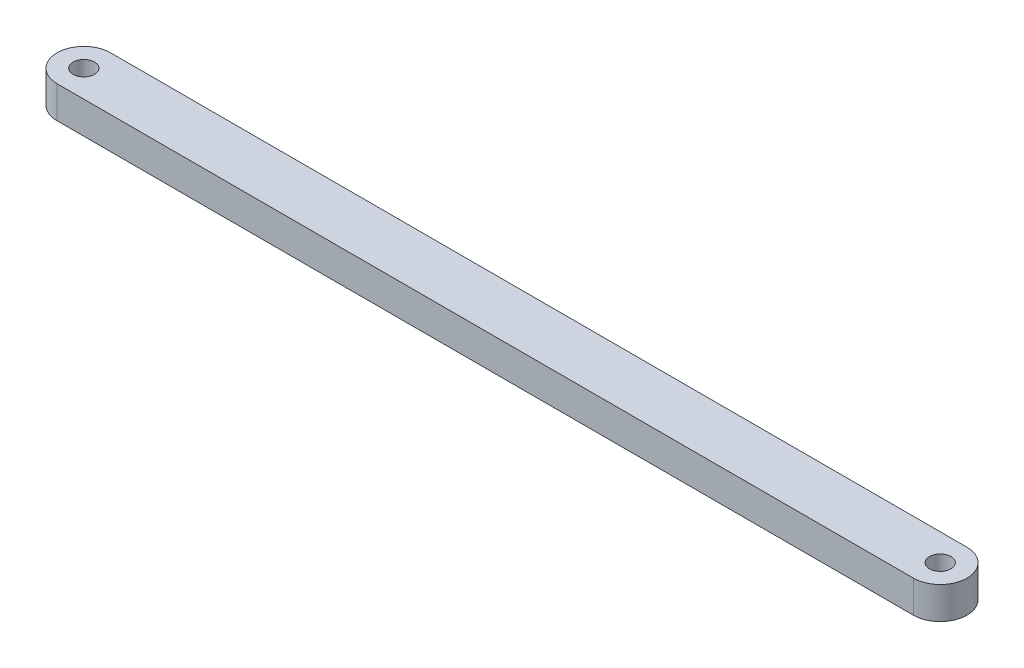
from build123d import *

# Parameters (mm, degrees)
SKETCH1_R           = 10
BOSS_EXTRUDE1_DEPTH = 30


with BuildPart() as part:
    # Sketch1 → Boss-Extrude1 (new body)
    with BuildSketch(Plane(origin=(0, 0, 0), x_dir=(1, 0, 0), z_dir=(0, 1, 0))):
        with BuildLine():
            Line((0, -25), (-800, -25))
            ThreePointArc((-800, -25), (-825, 0), (-800, 25))
            Line((-800, 25), (0, 25))
            ThreePointArc((0, 25), (25, 0), (0, -25))
        make_face()
        with Locations(Location((-800, 0, 0), (0, 0, 270))):
            Circle(SKETCH1_R, mode=Mode.SUBTRACT)
        with Locations(Location((0, 0, 0), (0, 0, 270))):
            Circle(SKETCH1_R, mode=Mode.SUBTRACT)
    extrude(amount=BOSS_EXTRUDE1_DEPTH)


solid = part.part
